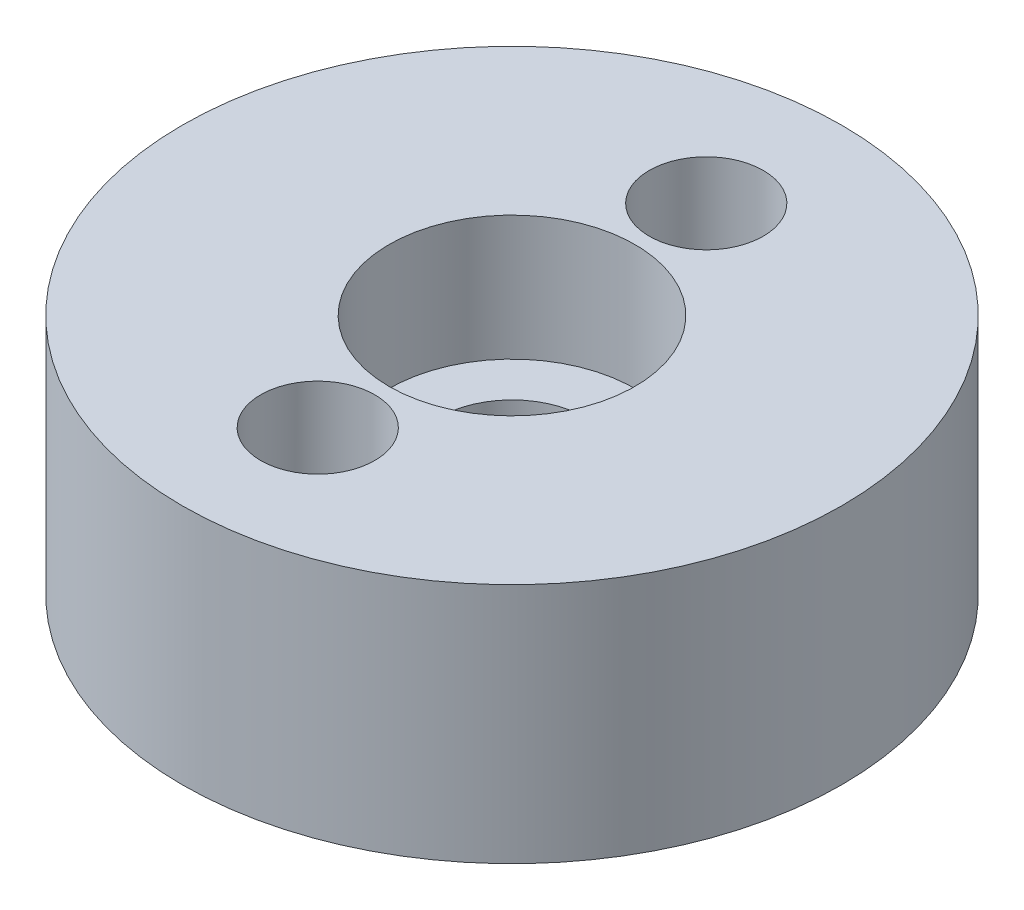
from build123d import *

# Parameters (mm, degrees)
SKETCH1_R           = 9.25
BOSS_EXTRUDE1_DEPTH = 6.78
SKETCH2_R           = 2.05
CUT_EXTRUDE1_DEPTH  = 15.734089724
SKETCH3_R           = 3.45
CUT_EXTRUDE2_DEPTH  = 3.5
SKETCH4_R           = 1.6
CUT_EXTRUDE3_DEPTH  = 15.734089724
CIRPATTERN1_COUNT   = 2
SKETCH5_R           = 2.75
CUT_EXTRUDE4_DEPTH  = 3
CIRPATTERN2_COUNT   = 2


with BuildPart() as part:
    # Sketch1 → Boss-Extrude1 (new body)
    with BuildSketch(Plane(origin=(0, 0, 0), x_dir=(1, 0, 0), z_dir=(0, 1, 0))):
        with Locations(Location((0, 0, 0), (0, 0, 270))):
            Circle(SKETCH1_R)
    extrude(amount=BOSS_EXTRUDE1_DEPTH)

    # Sketch2 → Cut-Extrude1 (cut, through all)
    with BuildSketch(Plane(origin=(0, 6.78, 0), x_dir=(1, 0, 0), z_dir=(0, 1, 0))):
        with Locations(Location((0, 0, 0), (0, 0, 270))):
            Circle(SKETCH2_R)
    extrude(amount=-CUT_EXTRUDE1_DEPTH, mode=Mode.SUBTRACT)

    # Sketch3 → Cut-Extrude2 (cut)
    with BuildSketch(Plane(origin=(0, 6.78, 0), x_dir=(1, 0, 0), z_dir=(0, 1, 0))):
        with Locations(Location((0, 0, 0), (0, 0, 270))):
            Circle(SKETCH3_R)
    extrude(amount=-CUT_EXTRUDE2_DEPTH, mode=Mode.SUBTRACT)

    # Sketch4 → Cut-Extrude3 (cut, through all)
    with BuildSketch(Plane(origin=(0, 0, 0), x_dir=(-1, 0, 0), z_dir=(0, -1, 0))):
        with Locations(Location((0, 5.45, 0), (0, 0, 90))):
            Circle(SKETCH4_R)
    cut_extrude3 = extrude(amount=-CUT_EXTRUDE3_DEPTH, mode=Mode.SUBTRACT)

    # CirPattern1: Cut-Extrude3 ×2 about axis
    cirpattern1_axis = Axis((0, 0, 0), (0, 1, 0))
    for i in range(1, CIRPATTERN1_COUNT):
        add(cut_extrude3.rotate(cirpattern1_axis, i * 360 / CIRPATTERN1_COUNT), mode=Mode.SUBTRACT)

    # Sketch5 → Cut-Extrude4 (cut)
    with BuildSketch(Plane(origin=(0, 0, 0), x_dir=(-1, 0, 0), z_dir=(0, -1, 0))):
        with Locations(Location((0, 5.45, 0), (0, 0, 90))):
            Circle(SKETCH5_R)
    cut_extrude4 = extrude(amount=-CUT_EXTRUDE4_DEPTH, mode=Mode.SUBTRACT)

    # CirPattern2: Cut-Extrude4 ×2 about axis
    cirpattern2_axis = Axis((0, 0, 0), (0, 1, 0))
    for i in range(1, CIRPATTERN2_COUNT):
        add(cut_extrude4.rotate(cirpattern2_axis, i * 360 / CIRPATTERN2_COUNT), mode=Mode.SUBTRACT)


solid = part.part
